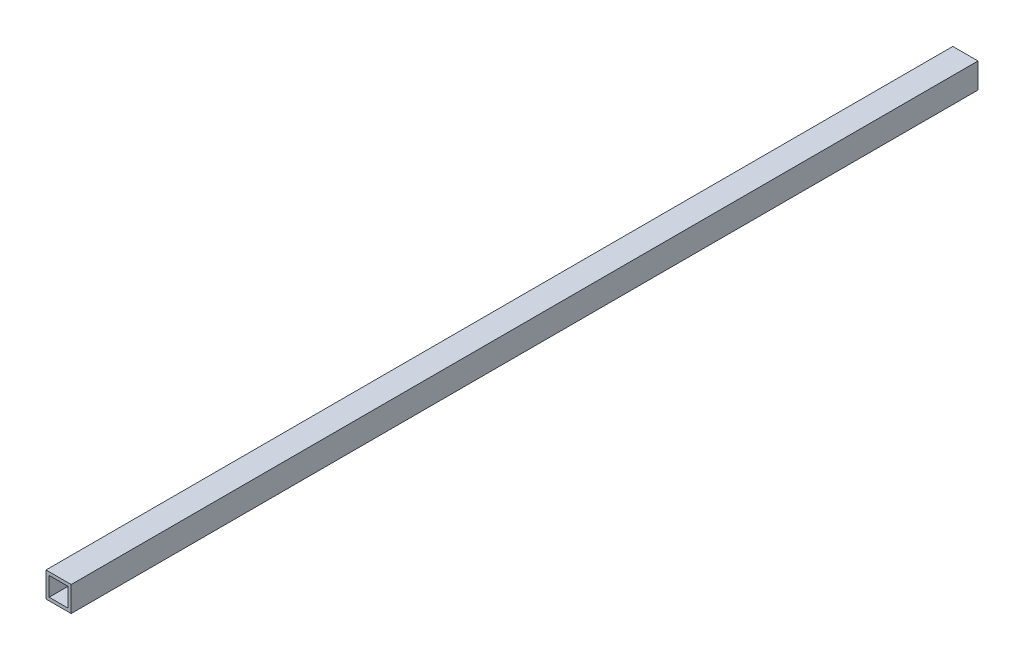
from build123d import *

# Parameters (mm, degrees)
SKETCH1_W           = 50.8
SKETCH1_H           = 50.8
SKETCH1_W_2         = 38.1
SKETCH1_H_2         = 38.1
BOSS_EXTRUDE1_DEPTH = 1828.8


with BuildPart() as part:
    # Sketch1 → Boss-Extrude1 (new body)
    with BuildSketch(Plane.XY):
        Rectangle(SKETCH1_W, SKETCH1_H)
        Rectangle(SKETCH1_W_2, SKETCH1_H_2, mode=Mode.SUBTRACT)
    extrude(amount=BOSS_EXTRUDE1_DEPTH)


solid = part.part
